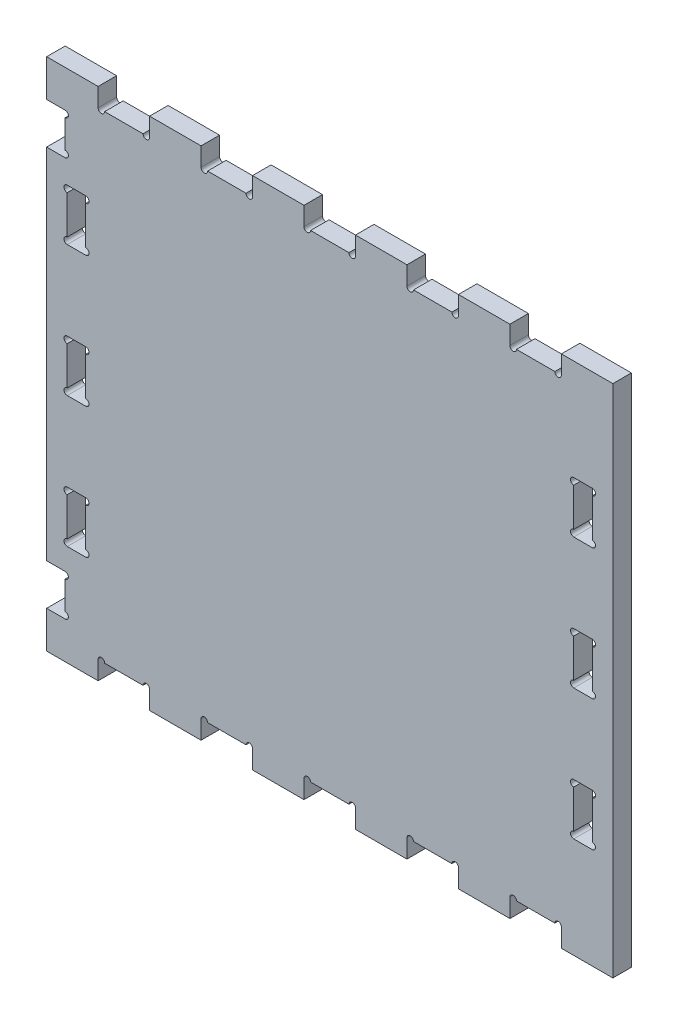
from build123d import *

# Parameters (mm, degrees)
ESTRUSIONE_ESTRUSIONE1_DEPTH = 18
TAGLIO_ESTRUSIONE1_DEPTH     = 115
TAGLIO_ESTRUSIONE2_DEPTH     = 258
TAGLIO_ESTRUSIONE3_DEPTH     = 723
TAGLIO_ESTRUSIONE4_DEPTH     = 160
TAGLIO_ESTRUSIONE5_DEPTH     = 190
TAGLIO_ESTRUSIONE6_DEPTH     = 231


with BuildPart() as part:
    # Schizzo2 → Estrusione-Estrusione1 (new body)
    with BuildSketch(Plane.XY):
        with BuildLine():
            Line((-275, -250), (-275, -214))
            Line((-275, -214), (-257, -214))
            ThreePointArc((-257, -214), (-253.825, -210.825), (-257, -207.65))
            Line((-257, -207.65), (-257, -180.35))
            ThreePointArc((-257, -180.35), (-253.825, -177.175), (-257, -174))
            Line((-257, -174), (-275, -174))
            Line((-275, -174), (-275, 174))
            Line((-275, 174), (-257, 174))
            ThreePointArc((-257, 174), (-253.825, 177.175), (-257, 180.35))
            Line((-257, 180.35), (-257, 207.65))
            ThreePointArc((-257, 207.65), (-253.825, 210.825), (-257, 214))
            Line((-257, 214), (-275, 214))
            Line((-275, 214), (-275, 250))
            Line((-275, 250), (-225, 250))
            Line((-225, 250), (-225, 232))
            ThreePointArc((-225, 232), (-221.825, 228.825), (-218.65, 232))
            Line((-218.65, 232), (-181.35, 232))
            ThreePointArc((-181.35, 232), (-178.175, 228.825), (-175, 232))
            Line((-175, 232), (-175, 250))
            Line((-175, 250), (-125, 250))
            Line((-125, 250), (-125, 232))
            ThreePointArc((-125, 232), (-121.825, 228.825), (-118.65, 232))
            Line((-118.65, 232), (-81.35, 232))
            ThreePointArc((-81.35, 232), (-78.175, 228.825), (-75, 232))
            Line((-75, 232), (-75, 250))
            Line((-75, 250), (-25, 250))
            Line((-25, 250), (-25, 232))
            ThreePointArc((-25, 232), (-21.825, 228.825), (-18.65, 232))
            Line((-18.65, 232), (18.65, 232))
            ThreePointArc((18.65, 232), (21.825, 228.825), (25, 232))
            Line((25, 232), (25, 250))
            Line((25, 250), (75, 250))
            Line((75, 250), (75, 232))
            ThreePointArc((75, 232), (78.175, 228.825), (81.35, 232))
            Line((81.35, 232), (118.65, 232))
            ThreePointArc((118.65, 232), (121.825, 228.825), (125, 232))
            Line((125, 232), (125, 250))
            Line((125, 250), (175, 250))
            Line((175, 250), (175, 232))
            ThreePointArc((175, 232), (178.175, 228.825), (181.35, 232))
            Line((181.35, 232), (218.65, 232))
            ThreePointArc((218.65, 232), (221.825, 228.825), (225, 232))
            Line((225, 232), (225, 250))
            Line((225, 250), (275, 250))
            Line((275, 250), (275, -250))
            Line((275, -250), (225, -250))
            Line((225, -250), (225, -232))
            ThreePointArc((225, -232), (221.825, -228.825), (218.65, -232))
            Line((218.65, -232), (181.35, -232))
            ThreePointArc((181.35, -232), (178.175, -228.825), (175, -232))
            Line((175, -232), (175, -250))
            Line((175, -250), (125, -250))
            Line((125, -250), (125, -232))
            ThreePointArc((125, -232), (121.825, -228.825), (118.65, -232))
            Line((118.65, -232), (81.35, -232))
            ThreePointArc((81.35, -232), (78.175, -228.825), (75, -232))
            Line((75, -232), (75, -250))
            Line((75, -250), (25, -250))
            Line((25, -250), (25, -232))
            ThreePointArc((25, -232), (21.825, -228.825), (18.65, -232))
            Line((18.65, -232), (-18.65, -232))
            ThreePointArc((-18.65, -232), (-21.825, -228.825), (-25, -232))
            Line((-25, -232), (-25, -250))
            Line((-25, -250), (-75, -250))
            Line((-75, -250), (-75, -232))
            ThreePointArc((-75, -232), (-78.175, -228.825), (-81.35, -232))
            Line((-81.35, -232), (-118.65, -232))
            ThreePointArc((-118.65, -232), (-121.825, -228.825), (-125, -232))
            Line((-125, -232), (-125, -250))
            Line((-125, -250), (-175, -250))
            Line((-175, -250), (-175, -232))
            ThreePointArc((-175, -232), (-178.175, -228.825), (-181.35, -232))
            Line((-181.35, -232), (-218.65, -232))
            ThreePointArc((-218.65, -232), (-221.825, -228.825), (-225, -232))
            Line((-225, -232), (-225, -250))
            Line((-225, -250), (-275, -250))
        make_face()
    extrude(amount=ESTRUSIONE_ESTRUSIONE1_DEPTH)

    # Schizzo2<4> → Taglio-Estrusione1 (cut)
    with BuildSketch(Plane.XY):
        with BuildLine():
            Line((237, 145.65), (237, 108.35))
            ThreePointArc((237, 108.35), (233.825, 105.175), (237, 102))
            Line((237, 102), (255, 102))
            ThreePointArc((255, 102), (258.175, 105.175), (255, 108.35))
            Line((255, 108.35), (255, 145.65))
            ThreePointArc((255, 145.65), (258.175, 148.825), (255, 152))
            Line((255, 152), (237, 152))
            ThreePointArc((237, 152), (233.825, 148.825), (237, 145.65))
        make_face()
    extrude(amount=TAGLIO_ESTRUSIONE1_DEPTH, mode=Mode.SUBTRACT)

    # Schizzo2<5> → Taglio-Estrusione2 (cut)
    with BuildSketch(Plane.XY):
        with BuildLine():
            Line((255, -18.65), (255, 18.65))
            ThreePointArc((255, 18.65), (258.175, 21.825), (255, 25))
            Line((255, 25), (237, 25))
            ThreePointArc((237, 25), (233.825, 21.825), (237, 18.65))
            Line((237, 18.65), (237, -18.65))
            ThreePointArc((237, -18.65), (233.825, -21.825), (237, -25))
            Line((237, -25), (255, -25))
            ThreePointArc((255, -25), (258.175, -21.825), (255, -18.65))
        make_face()
    extrude(amount=TAGLIO_ESTRUSIONE2_DEPTH, mode=Mode.SUBTRACT)

    # Schizzo2<7> → Taglio-Estrusione3 (cut)
    with BuildSketch(Plane.XY):
        with BuildLine():
            Line((255, -152), (237, -152))
            ThreePointArc((237, -152), (233.825, -148.825), (237, -145.65))
            Line((237, -145.65), (237, -108.35))
            ThreePointArc((237, -108.35), (233.825, -105.175), (237, -102))
            Line((237, -102), (255, -102))
            ThreePointArc((255, -102), (258.175, -105.175), (255, -108.35))
            Line((255, -108.35), (255, -145.65))
            ThreePointArc((255, -145.65), (258.175, -148.825), (255, -152))
        make_face()
    extrude(amount=TAGLIO_ESTRUSIONE3_DEPTH, mode=Mode.SUBTRACT)

    # Schizzo2<8> → Taglio-Estrusione4 (cut)
    with BuildSketch(Plane.XY):
        with BuildLine():
            Line((-255, 152), (-237, 152))
            ThreePointArc((-237, 152), (-233.825, 148.825), (-237, 145.65))
            Line((-237, 145.65), (-237, 108.35))
            ThreePointArc((-237, 108.35), (-233.825, 105.175), (-237, 102))
            Line((-237, 102), (-255, 102))
            ThreePointArc((-255, 102), (-258.175, 105.175), (-255, 108.35))
            Line((-255, 108.35), (-255, 145.65))
            ThreePointArc((-255, 145.65), (-258.175, 148.825), (-255, 152))
        make_face()
    extrude(amount=TAGLIO_ESTRUSIONE4_DEPTH, mode=Mode.SUBTRACT)

    # Schizzo2<9> → Taglio-Estrusione5 (cut)
    with BuildSketch(Plane.XY):
        with BuildLine():
            Line((-255, 25), (-237, 25))
            ThreePointArc((-237, 25), (-233.825, 21.825), (-237, 18.65))
            Line((-237, 18.65), (-237, -18.65))
            ThreePointArc((-237, -18.65), (-233.825, -21.825), (-237, -25))
            Line((-237, -25), (-255, -25))
            ThreePointArc((-255, -25), (-258.175, -21.825), (-255, -18.65))
            Line((-255, -18.65), (-255, 18.65))
            ThreePointArc((-255, 18.65), (-258.175, 21.825), (-255, 25))
        make_face()
    extrude(amount=TAGLIO_ESTRUSIONE5_DEPTH, mode=Mode.SUBTRACT)

    # Schizzo2<10> → Taglio-Estrusione6 (cut)
    with BuildSketch(Plane.XY):
        with BuildLine():
            Line((-237, -145.65), (-237, -108.35))
            ThreePointArc((-237, -108.35), (-233.825, -105.175), (-237, -102))
            Line((-237, -102), (-255, -102))
            ThreePointArc((-255, -102), (-258.175, -105.175), (-255, -108.35))
            Line((-255, -108.35), (-255, -145.65))
            ThreePointArc((-255, -145.65), (-258.175, -148.825), (-255, -152))
            Line((-255, -152), (-237, -152))
            ThreePointArc((-237, -152), (-233.825, -148.825), (-237, -145.65))
        make_face()
    extrude(amount=TAGLIO_ESTRUSIONE6_DEPTH, mode=Mode.SUBTRACT)


solid = part.part
